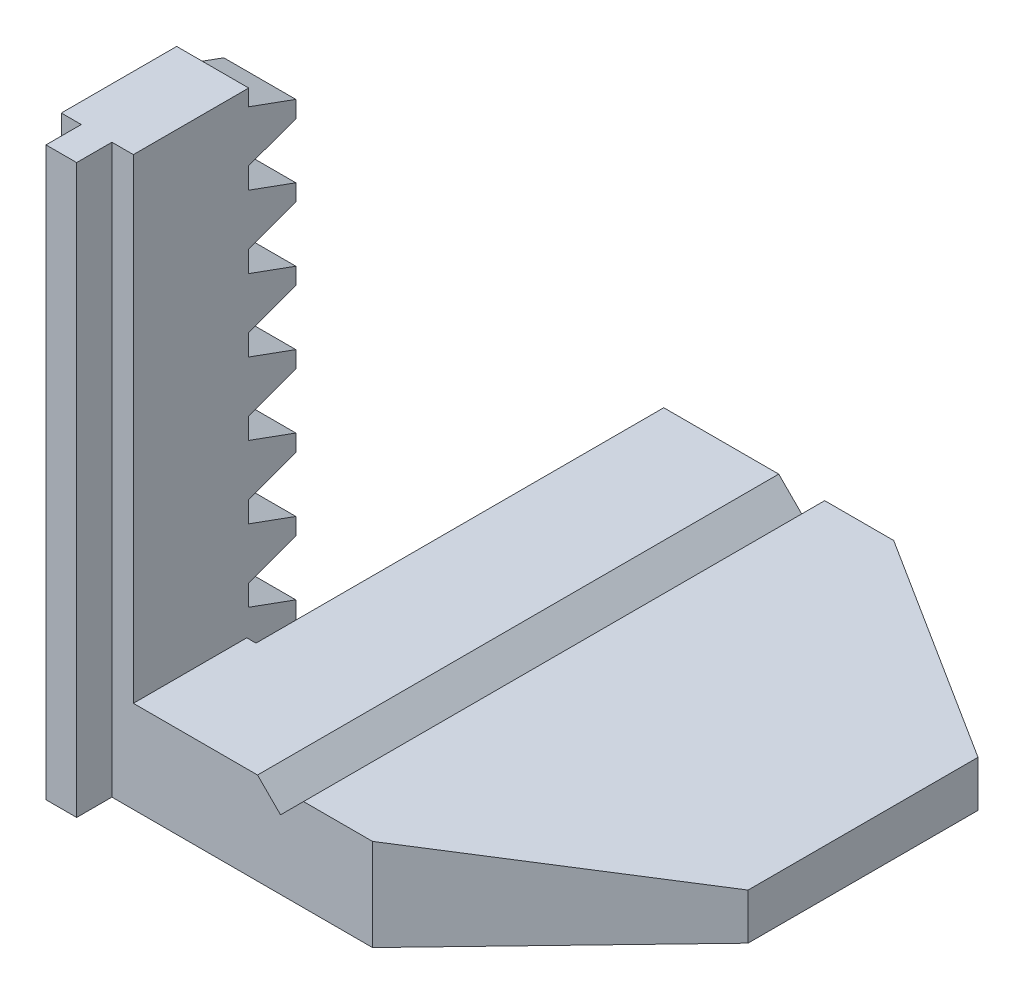
from build123d import *

# Parameters (mm, degrees)
BOSS_EXTRUDE1_DEPTH = 4.7
SKETCH2_W           = 2.4
SKETCH2_H           = 37
BOSS_EXTRUDE2_DEPTH = 2
SKETCH3_W           = 7.4
SKETCH3_H           = 6
BOSS_EXTRUDE3_DEPTH = 0.8
SKETCH4_W           = 31
SKETCH4_H           = 6
BOSS_EXTRUDE4_DEPTH = 30
CUT_EXTRUDE4_DEPTH  = 4.7
SKETCH9_W           = 3
SKETCH9_H           = 6
BOSS_EXTRUDE6_DEPTH = 30
CUT_EXTRUDE5_DEPTH  = 405.447882922
CUT_EXTRUDE6_DEPTH  = 405.447882922
CUT_EXTRUDE7_DEPTH  = 6.5


with BuildPart() as part:
    # Sketch1 → Boss-Extrude1 (new body)
    with BuildSketch(Plane(origin=(209.7, 0, 0), x_dir=(0, 0, -1), z_dir=(1, 0, 0))):
        Polygon((-318, -6), (-318, 31), (-310.475, 31), (-310.475, 30.0599), (-307.4, 28.9407), (-307.4, 27.608), (-310.475, 26.4888), (-310.475, 25.3475), (-307.4, 24.2283), (-307.4, 22.8956), (-310.475, 21.7764), (-310.475, 20.6351), (-307.4, 19.5159), (-307.4, 18.1832), (-310.475, 17.064), (-310.475, 15.9227), (-307.4, 14.8035), (-307.4, 13.4708), (-310.475, 12.3516), (-310.475, 11.2103), (-307.4, 10.0911), (-307.4, 8.7584), (-310.475, 7.6392), (-310.475, 6.4979), (-307.4, 5.3787), (-307.4, 4.0461), (-310.475, 2.9268), (-310.475, 1.7855), (-307.4, 0.6663), (-307.4, -0.6663), (-310.475, -1.7855), (-310.475, -2.9268), (-307.4, -4.0461), (-307.4, -5.3787), (-309.1069, -6), align=None)
    extrude(amount=BOSS_EXTRUDE1_DEPTH)

    # Sketch2 → Boss-Extrude2 (add)
    with BuildSketch(Plane(origin=(211, 0, 0), x_dir=(0, 0, -1), z_dir=(1, 0, 0))):
        with Locations((-319.1, 12.5)):
            Rectangle(SKETCH2_W, SKETCH2_H)
    extrude(amount=BOSS_EXTRUDE2_DEPTH)

    # Sketch3 → Boss-Extrude3 (add)
    with BuildSketch(Plane(origin=(214.4, 0, 0), x_dir=(0, 0, -1), z_dir=(1, 0, 0))):
        with Locations((-314.3, -3)):
            Rectangle(SKETCH3_W, SKETCH3_H)
    extrude(amount=BOSS_EXTRUDE3_DEPTH)

    # Sketch4 → Boss-Extrude4 (add)
    with BuildSketch(Plane(origin=(215, 0, 0), x_dir=(0, 0, -1), z_dir=(1, 0, 0))):
        with Locations((-302.5, -3)):
            Rectangle(SKETCH4_W, SKETCH4_H)
    extrude(amount=BOSS_EXTRUDE4_DEPTH)

    # Sketch8 → Cut-Extrude4 (cut, symmetric)
    with BuildSketch(Plane(origin=(209.7, 0, 0), x_dir=(0, 0, -1), z_dir=(1, 0, 0))):
        Polygon((-307, -4.1716), (-310.475, -2.907), (-310.475, -3.047), (-307, -4.3116), align=None)
        Polygon((-307, -5.2532), (-310.475, -6.5178), (-310.475, -6.3778), (-307, -5.1132), align=None)
        Polygon((-307, 0.5408), (-310.475, 1.8054), (-310.475, 1.6654), (-307, 0.4008), align=None)
        Polygon((-307, -0.5408), (-310.475, -1.8054), (-310.475, -1.6654), (-307, -0.4008), align=None)
        Polygon((-307, 5.2532), (-310.475, 6.5178), (-310.475, 6.3778), (-307, 5.1132), align=None)
        Polygon((-307, 4.1716), (-310.475, 2.907), (-310.475, 3.047), (-307, 4.3116), align=None)
        Polygon((-307, 9.9656), (-310.475, 11.2302), (-310.475, 11.0902), (-307, 9.8256), align=None)
        Polygon((-307, 8.884), (-310.475, 7.6194), (-310.475, 7.7594), (-307, 9.024), align=None)
        Polygon((-307, 14.678), (-310.475, 15.9426), (-310.475, 15.8026), (-307, 14.538), align=None)
        Polygon((-307, 13.5964), (-310.475, 12.3318), (-310.475, 12.4718), (-307, 13.7364), align=None)
        Polygon((-307, 19.3904), (-310.475, 20.655), (-310.475, 20.515), (-307, 19.2504), align=None)
        Polygon((-307, 18.3088), (-310.475, 17.0442), (-310.475, 17.1842), (-307, 18.4488), align=None)
        Polygon((-307, 24.1027), (-310.475, 25.3673), (-310.475, 25.2274), (-307, 23.9628), align=None)
        Polygon((-307, 23.0211), (-310.475, 21.7565), (-310.475, 21.8965), (-307, 23.1611), align=None)
        Polygon((-307, 28.8151), (-310.475, 30.0797), (-310.475, 29.9397), (-307, 28.6751), align=None)
        Polygon((-307, 27.7335), (-310.475, 26.4689), (-310.475, 26.6089), (-307, 27.8735), align=None)
    extrude(amount=CUT_EXTRUDE4_DEPTH, both=True, mode=Mode.SUBTRACT)

    # Sketch9 → Boss-Extrude6 (add)
    with BuildSketch(Plane(origin=(215, 0, 0), x_dir=(0, 0, -1), z_dir=(1, 0, 0))):
        with Locations((-285.5, -3)):
            Rectangle(SKETCH9_W, SKETCH9_H)
    extrude(amount=BOSS_EXTRUDE6_DEPTH)

    # Sketch10 → Cut-Extrude5 (cut, through all)
    with BuildSketch(Plane.XY):
        Polygon((227.5, -6.5), (246.5, -2.7), (246.5, -6.5), align=None)
    extrude(amount=CUT_EXTRUDE5_DEPTH, mode=Mode.SUBTRACT)

    # Sketch11 → Cut-Extrude6 (cut, through all)
    with BuildSketch(Plane.XY):
        Polygon((222, 0.5), (226, 0.5), (224, -1.5), align=None)
    extrude(amount=CUT_EXTRUDE6_DEPTH, mode=Mode.SUBTRACT)

    # Sketch12 → Cut-Extrude7 (cut, symmetric)
    with BuildSketch(Plane(origin=(0, 0, 0), x_dir=(1, 0, 0), z_dir=(0, 1, 0))):
        Polygon((228.125, -319.1875), (246.5, -307.55), (246.5, -319.1875), align=None)
        Polygon((228.125, -282.8125), (246.5, -294.45), (246.5, -282.8125), align=None)
    extrude(amount=CUT_EXTRUDE7_DEPTH, both=True, mode=Mode.SUBTRACT)


solid = part.part
